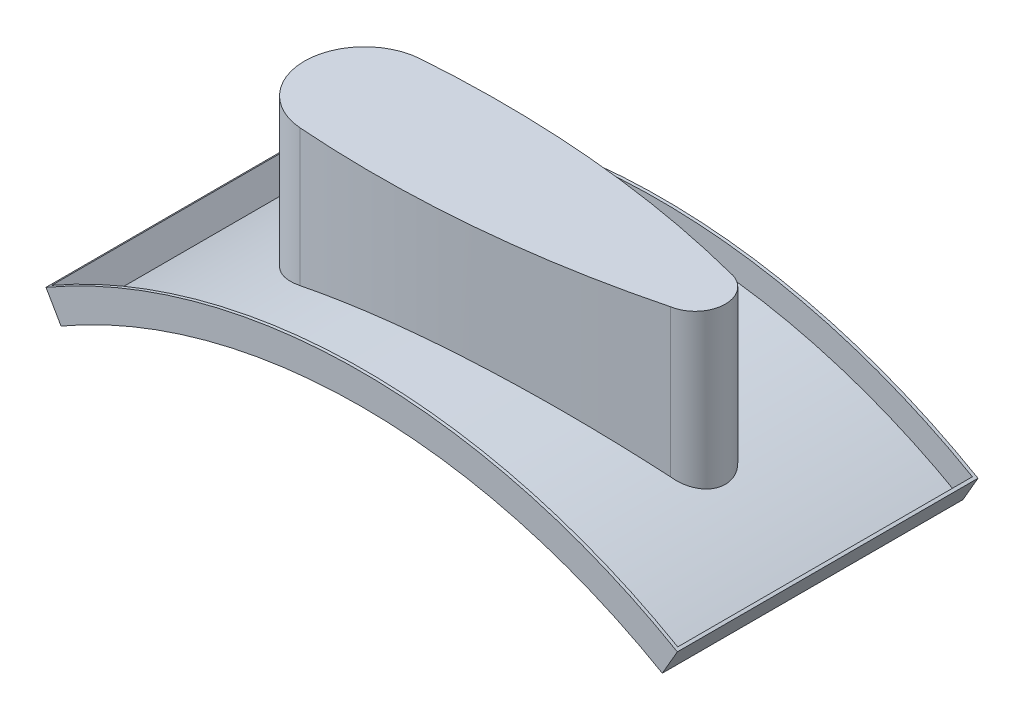
from build123d import *

# Parameters (mm, degrees)
BOSS_EXTRUDE1_DEPTH = 100
CUT_EXTRUDE1_DEPTH  = 98
BOSS_EXTRUDE2_DEPTH = 240
CUT_EXTRUDE2_DEPTH  = 305


with BuildPart() as part:
    # Sketch1 → Boss-Extrude1 (new body)
    with BuildSketch(Plane.XY):
        with BuildLine():
            Line((-105, 181.865334795), (-100, 173.205080757))
            ThreePointArc((-100, 173.205080757), (0, 200), (100, 173.205080757))
            Line((100, 173.205080757), (105, 181.865334795))
            ThreePointArc((105, 181.865334795), (0, 210), (-105, 181.865334795))
        make_face()
    extrude(amount=BOSS_EXTRUDE1_DEPTH)

    # Sketch2 → Cut-Extrude1 (cut)
    with BuildSketch(Plane(origin=(0, 0, 1), x_dir=(-1, 0, 0), z_dir=(0, 0, -1))):
        with BuildLine():
            Line((99.632730807, 174.568951855), (103.632778417, 181.497237548))
            ThreePointArc((103.632778417, 181.497237548), (0, 209), (-103.632778417, 181.497237548))
            Line((-103.632778417, 181.497237548), (-99.632730807, 174.568951855))
            ThreePointArc((-99.632730807, 174.568951855), (0, 201), (99.632730807, 174.568951855))
        make_face()
        with BuildLine():
            Line((-104.132784113, 182.363272818), (-103.632778417, 181.497237548))
            ThreePointArc((-103.632778417, 181.497237548), (0, 209), (103.632778417, 181.497237548))
            Line((103.632778417, 181.497237548), (104.132784113, 182.363272818))
            ThreePointArc((104.132784113, 182.363272818), (0, 210), (-104.132784113, 182.363272818))
        make_face()
        with BuildLine():
            Line((-105.359240795, 184.487558104), (-104.132784113, 182.363272818))
            ThreePointArc((-104.132784113, 182.363272818), (0, 210), (104.132784113, 182.363272818))
            Line((104.132784113, 182.363272818), (105.359240795, 184.487558104))
            ThreePointArc((105.359240795, 184.487558104), (0, 213.475505009), (-105.359240795, 184.487558104))
        make_face()
    extrude(amount=-CUT_EXTRUDE1_DEPTH, mode=Mode.SUBTRACT)

    # Sketch3 → Boss-Extrude2 (add)
    with BuildSketch(Plane(origin=(0, 0, 0), x_dir=(1, 0, 0), z_dir=(0, 1, 0))):
        with BuildLine():
            ThreePointArc((-50.533623167, -30.054914333), (-69.052556755, -50), (-50.533623167, -69.945085667))
            ThreePointArc((-50.533623167, -69.945085667), (6.462857127, -69.523597841), (62.635134299, -59.856556138))
            ThreePointArc((62.635134299, -59.856556138), (70.947443245, -50), (62.635134299, -40.143443862))
            ThreePointArc((62.635134299, -40.143443862), (6.462857127, -30.476402159), (-50.533623167, -30.054914333))
        make_face()
    extrude(amount=BOSS_EXTRUDE2_DEPTH)

    # Sketch4 → Cut-Extrude2 (cut)
    with BuildSketch(Plane.XY):
        with BuildLine():
            Line((-69.052556755, 187.701210453), (-109.027774, 39.169052656))
            Line((-109.027774, 39.169052656), (-56.106611476, -33.467837082))
            Line((-56.106611476, -33.467837082), (100.062701462, -27.760652889))
            Line((100.062701462, -27.760652889), (70.947443245, 186.993209227))
            ThreePointArc((70.947443245, 186.993209227), (1.01141739, 199.997442571), (-69.052556755, 187.701210453))
        make_face()
    extrude(amount=CUT_EXTRUDE2_DEPTH, mode=Mode.SUBTRACT)


solid = part.part
